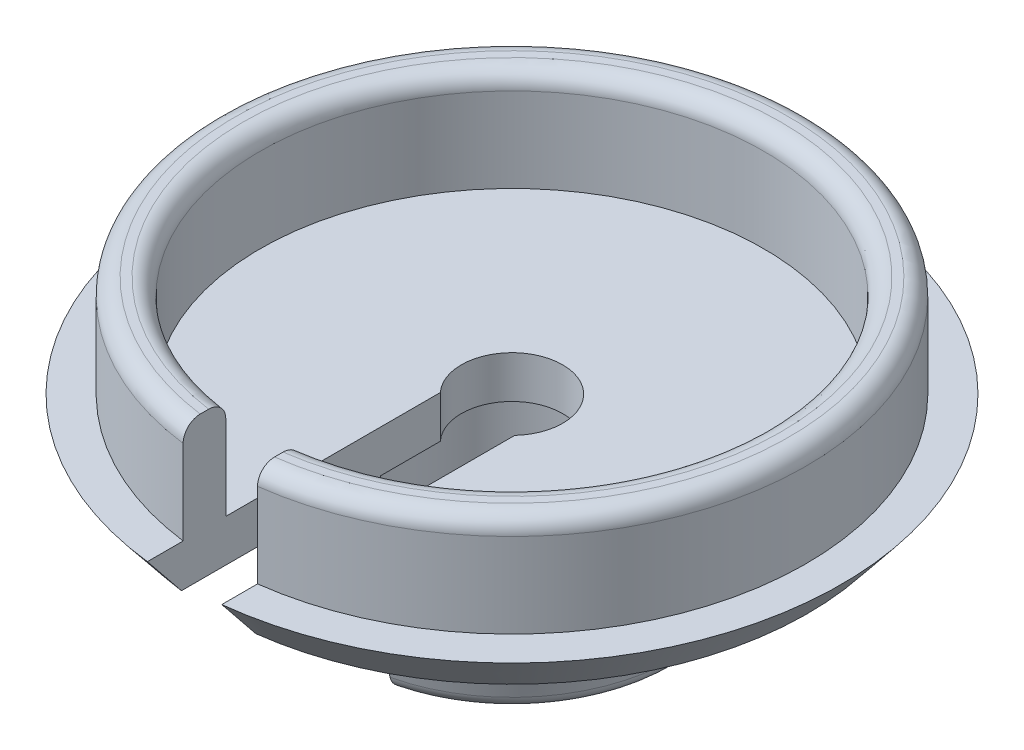
from build123d import *

# Parameters (mm, degrees)
FILLET1_R          = 0.5
SKETCH2_W          = 2.2
SKETCH2_H          = 12.020991071
CUT_EXTRUDE1_DEPTH = 5


with BuildPart() as part:
    # Sketch1 → Revolve1 (revolve)
    with BuildSketch(Plane.XY, mode=Mode.PRIVATE) as revolve1_sk:
        Polygon((1.5, 0), (1.5, 1.25), (7.45, 1.25), (7.45, 4.25), (8.7, 4.25), (8.7, 1.25), (9.75, 1.25), (8.75, 0), (5.5, 0), (4.75, -3.5), (3, -3.5), (3, 0), align=None)
    revolve(revolve1_sk.sketch.rotate(Axis((0, -16.601859786, 0), (0, 1, 0)), 90), axis=Axis((0, -16.601859786, 0), (0, 1, 0)))

    # Fillet1
    fillet1_edges = [part.edges().sort_by_distance(p)[0] for p in [
        (0, 4.25, 8.7),
        (0, 4.25, 7.45),
        (0, -3.5, 4.75),
        (0, 0, 5.5),
    ]]
    fillet(fillet1_edges, radius=FILLET1_R)

    # Sketch2 → Cut-Extrude1 (cut, symmetric)
    with BuildSketch(Plane(origin=(0, 0, 0), x_dir=(1, 0, 0), z_dir=(0, 1, 0))):
        with Locations((0, -6.010495536)):
            Rectangle(SKETCH2_W, SKETCH2_H)
    extrude(amount=CUT_EXTRUDE1_DEPTH, both=True, mode=Mode.SUBTRACT)


solid = part.part
